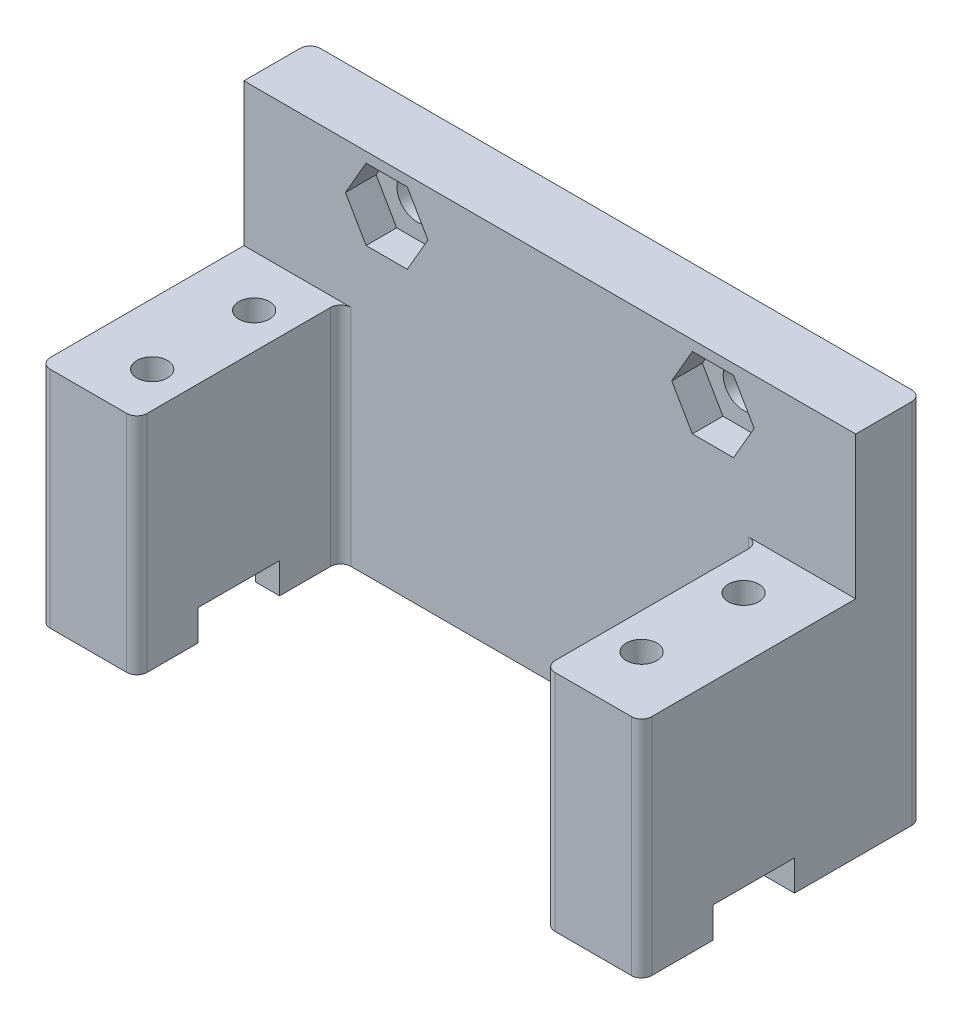
from build123d import *

# Parameters (mm, degrees)
SKETCH1_W           = 60
SKETCH1_H           = 36
SKETCH1_R           = 2
BOSS_EXTRUDE1_DEPTH = 6.5
SKETCH2_W           = 9.5
SKETCH2_H           = 20
SKETCH2_H_2         = 21
BOSS_EXTRUDE2_DEPTH = 22
CUT_EXTRUDE1_REACH  = 71.572
SKETCH3_R           = 1.5
CUT_EXTRUDE2_DEPTH  = 3
LPATTERN1_COUNT     = 2
LPATTERN1_PITCH     = 32
FILLET1_R           = 1
SKETCH6_W           = 8
SKETCH6_H           = 3
CUT_EXTRUDE3_DEPTH  = 76.181447179


with BuildPart() as part:
    # Sketch1 → Boss-Extrude1 (new body)
    with BuildSketch(Plane.XY):
        with Locations((30, -18)):
            Rectangle(SKETCH1_W, SKETCH1_H)
        with Locations(Location((14, -4.5, 0), (0, 0, 180))):
            Circle(SKETCH1_R, mode=Mode.SUBTRACT)
        with Locations(Location((46, -4.5, 0), (0, 0, 180))):
            Circle(SKETCH1_R, mode=Mode.SUBTRACT)
    extrude(amount=BOSS_EXTRUDE1_DEPTH)

    # Sketch2 → Boss-Extrude2 (add)
    with BuildSketch(Plane.XZ.offset(36)):
        with Locations((4.75, 16.5)):
            Rectangle(SKETCH2_W, SKETCH2_H)
        with Locations((55.25, 17)):
            Rectangle(SKETCH2_W, SKETCH2_H_2)
    extrude(amount=-BOSS_EXTRUDE2_DEPTH)

    # Sketch3 → Cut-Extrude1 (cut, up to next)
    with BuildSketch(Plane(origin=(0, -14, 0), x_dir=(1, 0, 0), z_dir=(0, 1, 0)), mode=Mode.PRIVATE) as cut_extrude1_sk1:
        with Locations(Location((6, -11.5, 0), (0, 0, 270))):
            Circle(SKETCH3_R)
    cut_extrude1_tool1 = extrude(cut_extrude1_sk1.sketch, amount=-CUT_EXTRUDE1_REACH, mode=Mode.PRIVATE) & part.part
    # Sketch3 → Cut-Extrude1 (cut, up to next)
    with BuildSketch(Plane(origin=(0, -14, 0), x_dir=(1, 0, 0), z_dir=(0, 1, 0)), mode=Mode.PRIVATE) as cut_extrude1_sk2:
        with Locations(Location((54, -11.5, 0), (0, 0, 270))):
            Circle(SKETCH3_R)
    cut_extrude1_tool2 = extrude(cut_extrude1_sk2.sketch, amount=-CUT_EXTRUDE1_REACH, mode=Mode.PRIVATE) & part.part
    # Sketch3 → Cut-Extrude1 (cut, up to next)
    with BuildSketch(Plane(origin=(0, -14, 0), x_dir=(1, 0, 0), z_dir=(0, 1, 0)), mode=Mode.PRIVATE) as cut_extrude1_sk3:
        with Locations(Location((54, -21.5, 0), (0, 0, 270))):
            Circle(SKETCH3_R)
    cut_extrude1_tool3 = extrude(cut_extrude1_sk3.sketch, amount=-CUT_EXTRUDE1_REACH, mode=Mode.PRIVATE) & part.part
    # Sketch3 → Cut-Extrude1 (cut, up to next)
    with BuildSketch(Plane(origin=(0, -14, 0), x_dir=(1, 0, 0), z_dir=(0, 1, 0)), mode=Mode.PRIVATE) as cut_extrude1_sk4:
        with Locations(Location((6, -21.5, 0), (0, 0, 270))):
            Circle(SKETCH3_R)
    cut_extrude1_tool4 = extrude(cut_extrude1_sk4.sketch, amount=-CUT_EXTRUDE1_REACH, mode=Mode.PRIVATE) & part.part
    add(cut_extrude1_tool1.solids().sort_by_distance((6, -14, 11.5))[0], mode=Mode.SUBTRACT)
    add(cut_extrude1_tool2.solids().sort_by_distance((54, -14, 11.5))[0], mode=Mode.SUBTRACT)
    add(cut_extrude1_tool3.solids().sort_by_distance((54, -14, 21.5))[0], mode=Mode.SUBTRACT)
    add(cut_extrude1_tool4.solids().sort_by_distance((6, -14, 21.5))[0], mode=Mode.SUBTRACT)

    # Sketch4 → Cut-Extrude2 (cut)
    with BuildSketch(Plane.XY.offset(6.5)):
        Polygon((11.979274058, -1), (9.958548116, -4.5), (11.979274058, -8), (16.020725942, -8), (18.041451884, -4.5), (16.020725942, -1), align=None)
    cut_extrude2 = extrude(amount=-CUT_EXTRUDE2_DEPTH, mode=Mode.SUBTRACT)

    # LPattern1: Cut-Extrude2 ×2
    with Locations(*[(i * LPATTERN1_PITCH, 0, 0) for i in range(1, LPATTERN1_COUNT)]):
        add(cut_extrude2, mode=Mode.SUBTRACT)

    # Fillet1
    fillet1_edges = [part.edges().sort_by_distance(p)[0] for p in [
        (0, -25, 26.5),
        (9.5, -25, 26.5),
        (9.5, -25, 6.5),
        (60, -25, 27.5),
        (50.5, -25, 6.5),
        (50.5, -25, 27.5),
        (60, -18, 0),
        (0, -18, 0),
    ]]
    fillet(fillet1_edges, radius=FILLET1_R)

    # Sketch6 → Cut-Extrude3 (cut, through all)
    with BuildSketch(Plane(origin=(60, 0, 0), x_dir=(0, 0, -1), z_dir=(1, 0, 0))):
        with Locations((-16.5, -34.5)):
            Rectangle(SKETCH6_W, SKETCH6_H)
    extrude(amount=-CUT_EXTRUDE3_DEPTH, mode=Mode.SUBTRACT)


solid = part.part
